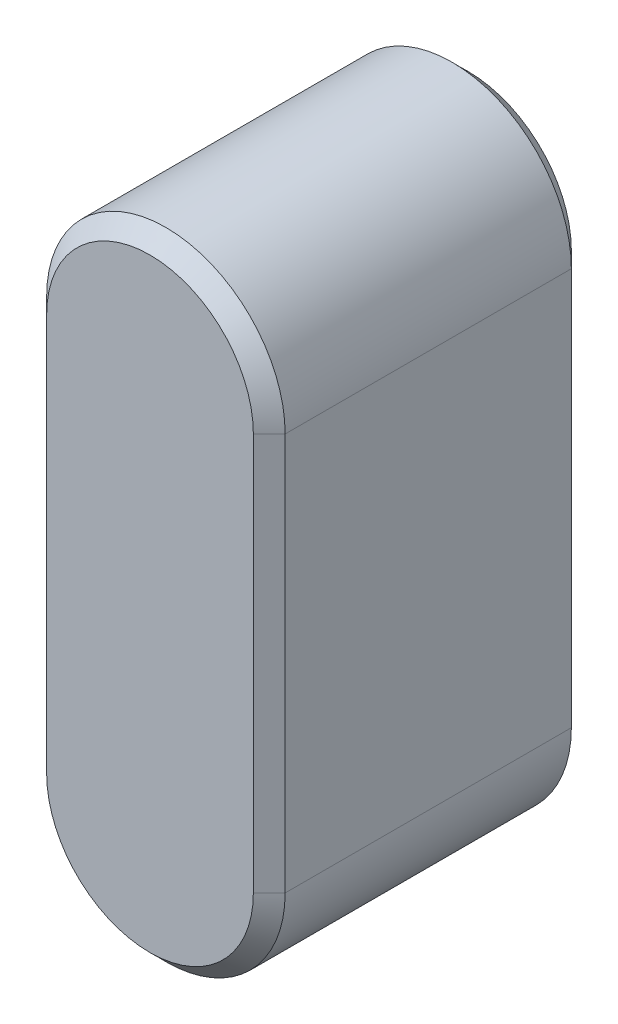
from build123d import *

# Parameters (mm, degrees)
EXTRUDE_1_DEPTH = 4
CHAMFER_1_SIZE  = 0.2


with BuildPart() as part:
    # 草图1 → 凸台-拉伸1 (new body)
    with BuildSketch(Plane.XY):
        with BuildLine():
            Line((-1.5, -2.5), (-1.5, 2.5))
            ThreePointArc((-1.5, 2.5), (0, 4), (1.5, 2.5))
            Line((1.5, 2.5), (1.5, -2.5))
            ThreePointArc((1.5, -2.5), (0, -4), (-1.5, -2.5))
        make_face()
    extrude(amount=EXTRUDE_1_DEPTH)

    # 倒角1
    chamfer_1_edges = [part.edges().sort_by_distance(p)[0] for p in [
        (0, 4, 4),
        (-1.5, 0, 4),
        (0, -4, 4),
        (-1.5, 0, 0),
        (0, 4, 0),
        (1.5, 0, 0),
        (0, -4, 0),
        (1.5, 0, 4),
    ]]
    chamfer(chamfer_1_edges, length=CHAMFER_1_SIZE)


solid = part.part
